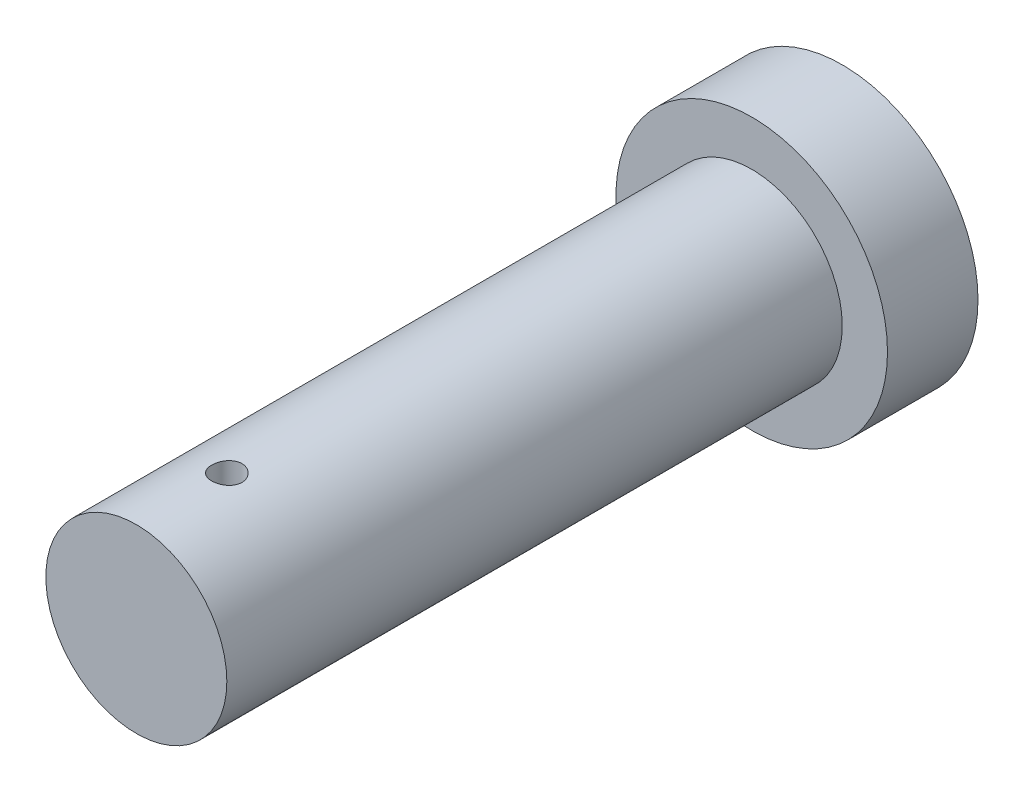
from build123d import *

# Parameters (mm, degrees)
SKETCH1_R           = 22.5
BOSS_EXTRUDE1_DEPTH = 15
SKETCH2_R           = 15
BOSS_EXTRUDE2_DEPTH = 102
SKETCH3_R           = 2.5
CUT_EXTRUDE1_DEPTH  = 51


with BuildPart() as part:
    # Sketch1 → Boss-Extrude1 (new body)
    with BuildSketch(Plane.XY):
        Circle(SKETCH1_R)
    extrude(amount=BOSS_EXTRUDE1_DEPTH)

    # Sketch2 → Boss-Extrude2 (add)
    with BuildSketch(Plane.XY.offset(15)):
        Circle(SKETCH2_R)
    extrude(amount=BOSS_EXTRUDE2_DEPTH)

    # Sketch3 → Cut-Extrude1 (cut, symmetric)
    with BuildSketch(Plane(origin=(0, 0, 0), x_dir=(1, 0, 0), z_dir=(0, 1, 0))):
        with Locations(Location((0, -102, 0), (0, 0, 270))):
            Circle(SKETCH3_R)
    extrude(amount=CUT_EXTRUDE1_DEPTH, both=True, mode=Mode.SUBTRACT)


solid = part.part
